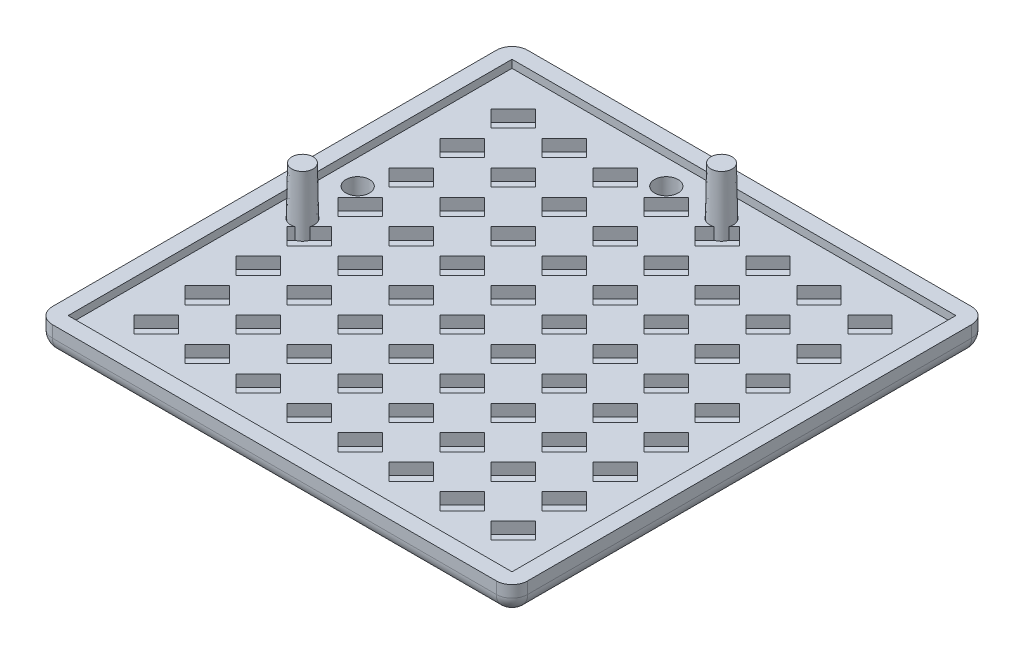
from build123d import *

# Parameters (mm, degrees)
SKETCH1_W                     = 60.6
SKETCH1_H                     = 60.6
BOSS_EXTRUDE1_DEPTH           = 3.5
CUT_EXTRUDE1_START            = -1
CUT_EXTRUDE1_DEPTH            = 42.993371582
CUT_EXTRUDE2_START            = -1
SKETCH3_W                     = 56.6
SKETCH3_H                     = 56.6
CUT_EXTRUDE2_DEPTH            = 44.993371582
SKETCH4_R                     = 1.5
CUT_EXTRUDE3_DEPTH            = 43.993371582
BOSS_EXTRUDE3_START           = -3.5
SKETCH5_R                     = 1.5
BOSS_EXTRUDE3_DEPTH           = 8.6
BOSS_EXTRUDE3_DRAFT           = 1
BOSS_EXTRUDE3_PROFILE_2_DEPTH = 8.6
BOSS_EXTRUDE3_PROFILE_2_DRAFT = 1
FILLET3_R                     = 2
FILLET4_R                     = 2


with BuildPart() as part:
    # Sketch1 → Boss-Extrude1 (new body)
    with BuildSketch(Plane(origin=(0, 0, 0), x_dir=(1, 0, 0), z_dir=(0, 1, 0))):
        Rectangle(SKETCH1_W, SKETCH1_H)
    extrude(amount=BOSS_EXTRUDE1_DEPTH)

    # led → Cut-Extrude1 (cut, through all)
    with BuildSketch(Plane.XZ.offset(CUT_EXTRUDE1_START)):
        Polygon((22.471572875, -20.350252532), (25.3, -23.178679656), (23.178679656, -25.3), (20.350252532, -22.471572875), align=None)
        Polygon((13.850252532, -22.471572875), (16.678679656, -25.3), (18.8, -23.178679656), (15.971572875, -20.350252532), align=None)
        Polygon((7.350252532, -22.471572875), (10.178679656, -25.3), (12.3, -23.178679656), (9.471572875, -20.350252532), align=None)
        Polygon((0.850252532, -22.471572875), (3.678679656, -25.3), (5.8, -23.178679656), (2.971572875, -20.350252532), align=None)
        Polygon((-5.649747468, -22.471572875), (-2.821320344, -25.3), (-0.7, -23.178679656), (-3.528427125, -20.350252532), align=None)
        Polygon((-12.149747468, -22.471572875), (-9.321320344, -25.3), (-7.2, -23.178679656), (-10.028427125, -20.350252532), align=None)
        Polygon((-18.649747468, -22.471572875), (-15.821320344, -25.3), (-13.7, -23.178679656), (-16.528427125, -20.350252532), align=None)
        Polygon((-25.149747468, -22.471572875), (-22.321320344, -25.3), (-20.2, -23.178679656), (-23.028427125, -20.350252532), align=None)
        Polygon((13.850252532, -15.971572875), (16.678679656, -18.8), (18.8, -16.678679656), (15.971572875, -13.850252532), align=None)
        Polygon((7.350252532, -15.971572875), (10.178679656, -18.8), (12.3, -16.678679656), (9.471572875, -13.850252532), align=None)
        Polygon((0.850252532, -15.971572875), (3.678679656, -18.8), (5.8, -16.678679656), (2.971572875, -13.850252532), align=None)
        Polygon((-5.649747468, -15.971572875), (-2.821320344, -18.8), (-0.7, -16.678679656), (-3.528427125, -13.850252532), align=None)
        Polygon((-12.149747468, -15.971572875), (-9.321320344, -18.8), (-7.2, -16.678679656), (-10.028427125, -13.850252532), align=None)
        Polygon((-18.649747468, -15.971572875), (-15.821320344, -18.8), (-13.7, -16.678679656), (-16.528427125, -13.850252532), align=None)
        Polygon((-25.149747468, -15.971572875), (-22.321320344, -18.8), (-20.2, -16.678679656), (-23.028427125, -13.850252532), align=None)
        Polygon((13.850252532, -9.471572875), (16.678679656, -12.3), (18.8, -10.178679656), (15.971572875, -7.350252532), align=None)
        Polygon((7.350252532, -9.471572875), (10.178679656, -12.3), (12.3, -10.178679656), (9.471572875, -7.350252532), align=None)
        Polygon((0.850252532, -9.471572875), (3.678679656, -12.3), (5.8, -10.178679656), (2.971572875, -7.350252532), align=None)
        Polygon((-5.649747468, -9.471572875), (-2.821320344, -12.3), (-0.7, -10.178679656), (-3.528427125, -7.350252532), align=None)
        Polygon((-12.149747468, -9.471572875), (-9.321320344, -12.3), (-7.2, -10.178679656), (-10.028427125, -7.350252532), align=None)
        Polygon((-18.649747468, -9.471572875), (-15.821320344, -12.3), (-13.7, -10.178679656), (-16.528427125, -7.350252532), align=None)
        Polygon((-25.149747468, -9.471572875), (-22.321320344, -12.3), (-20.2, -10.178679656), (-23.028427125, -7.350252532), align=None)
        Polygon((13.850252532, -2.971572875), (16.678679656, -5.8), (18.8, -3.678679656), (15.971572875, -0.850252532), align=None)
        Polygon((7.350252532, -2.971572875), (10.178679656, -5.8), (12.3, -3.678679656), (9.471572875, -0.850252532), align=None)
        Polygon((0.850252532, -2.971572875), (3.678679656, -5.8), (5.8, -3.678679656), (2.971572875, -0.850252532), align=None)
        Polygon((-5.649747468, -2.971572875), (-2.821320344, -5.8), (-0.7, -3.678679656), (-3.528427125, -0.850252532), align=None)
        Polygon((-12.149747468, -2.971572875), (-9.321320344, -5.8), (-7.2, -3.678679656), (-10.028427125, -0.850252532), align=None)
        Polygon((-18.649747468, -2.971572875), (-15.821320344, -5.8), (-13.7, -3.678679656), (-16.528427125, -0.850252532), align=None)
        Polygon((-25.149747468, -2.971572875), (-22.321320344, -5.8), (-20.2, -3.678679656), (-23.028427125, -0.850252532), align=None)
        Polygon((13.850252532, 3.528427125), (16.678679656, 0.7), (18.8, 2.821320344), (15.971572875, 5.649747468), align=None)
        Polygon((7.350252532, 3.528427125), (10.178679656, 0.7), (12.3, 2.821320344), (9.471572875, 5.649747468), align=None)
        Polygon((0.850252532, 3.528427125), (3.678679656, 0.7), (5.8, 2.821320344), (2.971572875, 5.649747468), align=None)
        Polygon((-5.649747468, 3.528427125), (-2.821320344, 0.7), (-0.7, 2.821320344), (-3.528427125, 5.649747468), align=None)
        Polygon((-12.149747468, 3.528427125), (-9.321320344, 0.7), (-7.2, 2.821320344), (-10.028427125, 5.649747468), align=None)
        Polygon((-18.649747468, 3.528427125), (-15.821320344, 0.7), (-13.7, 2.821320344), (-16.528427125, 5.649747468), align=None)
        Polygon((-25.149747468, 3.528427125), (-22.321320344, 0.7), (-20.2, 2.821320344), (-23.028427125, 5.649747468), align=None)
        Polygon((13.850252532, 10.028427125), (16.678679656, 7.2), (18.8, 9.321320344), (15.971572875, 12.149747468), align=None)
        Polygon((7.350252532, 10.028427125), (10.178679656, 7.2), (12.3, 9.321320344), (9.471572875, 12.149747468), align=None)
        Polygon((0.850252532, 10.028427125), (3.678679656, 7.2), (5.8, 9.321320344), (2.971572875, 12.149747468), align=None)
        Polygon((-5.649747468, 10.028427125), (-2.821320344, 7.2), (-0.7, 9.321320344), (-3.528427125, 12.149747468), align=None)
        Polygon((-12.149747468, 10.028427125), (-9.321320344, 7.2), (-7.2, 9.321320344), (-10.028427125, 12.149747468), align=None)
        Polygon((-18.649747468, 10.028427125), (-15.821320344, 7.2), (-13.7, 9.321320344), (-16.528427125, 12.149747468), align=None)
        Polygon((-25.149747468, 10.028427125), (-22.321320344, 7.2), (-20.2, 9.321320344), (-23.028427125, 12.149747468), align=None)
        Polygon((13.850252532, 16.528427125), (16.678679656, 13.7), (18.8, 15.821320344), (15.971572875, 18.649747468), align=None)
        Polygon((7.350252532, 16.528427125), (10.178679656, 13.7), (12.3, 15.821320344), (9.471572875, 18.649747468), align=None)
        Polygon((0.850252532, 16.528427125), (3.678679656, 13.7), (5.8, 15.821320344), (2.971572875, 18.649747468), align=None)
        Polygon((-5.649747468, 16.528427125), (-2.821320344, 13.7), (-0.7, 15.821320344), (-3.528427125, 18.649747468), align=None)
        Polygon((-12.149747468, 16.528427125), (-9.321320344, 13.7), (-7.2, 15.821320344), (-10.028427125, 18.649747468), align=None)
        Polygon((-18.649747468, 16.528427125), (-15.821320344, 13.7), (-13.7, 15.821320344), (-16.528427125, 18.649747468), align=None)
        Polygon((-25.149747468, 16.528427125), (-22.321320344, 13.7), (-20.2, 15.821320344), (-23.028427125, 18.649747468), align=None)
        Polygon((13.850252532, 23.028427125), (16.678679656, 20.2), (18.8, 22.321320344), (15.971572875, 25.149747468), align=None)
        Polygon((7.350252532, 23.028427125), (10.178679656, 20.2), (12.3, 22.321320344), (9.471572875, 25.149747468), align=None)
        Polygon((0.850252532, 23.028427125), (3.678679656, 20.2), (5.8, 22.321320344), (2.971572875, 25.149747468), align=None)
        Polygon((-5.649747468, 23.028427125), (-2.821320344, 20.2), (-0.7, 22.321320344), (-3.528427125, 25.149747468), align=None)
        Polygon((-12.149747468, 23.028427125), (-9.321320344, 20.2), (-7.2, 22.321320344), (-10.028427125, 25.149747468), align=None)
        Polygon((-18.649747468, 23.028427125), (-15.821320344, 20.2), (-13.7, 22.321320344), (-16.528427125, 25.149747468), align=None)
        Polygon((-25.149747468, 23.028427125), (-22.321320344, 20.2), (-20.2, 22.321320344), (-23.028427125, 25.149747468), align=None)
        Polygon((20.350252532, -15.971572875), (23.178679656, -18.8), (25.3, -16.678679656), (22.471572875, -13.850252532), align=None)
        Polygon((20.350252532, -9.471572875), (23.178679656, -12.3), (25.3, -10.178679656), (22.471572875, -7.350252532), align=None)
        Polygon((20.350252532, -2.971572875), (23.178679656, -5.8), (25.3, -3.678679656), (22.471572875, -0.850252532), align=None)
        Polygon((20.350252532, 3.528427125), (23.178679656, 0.7), (25.3, 2.821320344), (22.471572875, 5.649747468), align=None)
        Polygon((20.350252532, 10.028427125), (23.178679656, 7.2), (25.3, 9.321320344), (22.471572875, 12.149747468), align=None)
        Polygon((20.350252532, 16.528427125), (23.178679656, 13.7), (25.3, 15.821320344), (22.471572875, 18.649747468), align=None)
        Polygon((20.350252532, 23.028427125), (23.178679656, 20.2), (25.3, 22.321320344), (22.471572875, 25.149747468), align=None)
    extrude(amount=-CUT_EXTRUDE1_DEPTH, mode=Mode.SUBTRACT)

    # Sketch3 → Cut-Extrude2 (cut, through all)
    with BuildSketch(Plane(origin=(0, 3.5, 0), x_dir=(1, 0, 0), z_dir=(0, 1, 0)).offset(CUT_EXTRUDE2_START)):
        Rectangle(SKETCH3_W, SKETCH3_H)
    extrude(amount=CUT_EXTRUDE2_DEPTH, mode=Mode.SUBTRACT)

    # Sketch4 → Cut-Extrude3 (cut, through all)
    with BuildSketch(Plane(origin=(0, 3.5, 0), x_dir=(1, 0, 0), z_dir=(0, 1, 0))):
        with Locations(Location((1.6, 25.12, 0), (0, 0, 270))):
            Circle(SKETCH4_R)
        with Locations(Location((-5.44, 25.12, 0), (0, 0, 270))):
            Circle(SKETCH4_R)
        with Locations(Location((-25.12, 5.44, 0), (0, 0, 270))):
            Circle(SKETCH4_R)
        with Locations(Location((-25.12, -1.6, 0), (0, 0, 288.514361265))):
            Circle(SKETCH4_R)
    extrude(amount=-CUT_EXTRUDE3_DEPTH, mode=Mode.SUBTRACT)

    # Fillet3
    fillet3_edges = [part.edges().sort_by_distance(p)[0] for p in [
        (30.3, 1.75, 30.3),
        (-30.3, 1.75, 30.3),
        (-30.3, 1.75, -30.3),
        (30.3, 1.75, -30.3),
    ]]
    fillet(fillet3_edges, radius=FILLET3_R)

    # Fillet4
    fillet4_edges = [part.edges().sort_by_distance(p)[0] for p in [
        (0, 0, 30.3),
        (30.3, 0, 0),
        (-30.3, 0, 0),
        (0, 0, -30.3),
        (29.714213562, 0, 29.714213562),
        (29.714213562, 0, -29.714213562),
        (-29.714213562, 0, -29.714213562),
        (-29.714213562, 0, 29.714213562),
    ]]
    fillet(fillet4_edges, radius=FILLET4_R)


with BuildPart() as body_2:
    # Sketch5 → Boss-Extrude3 (with draft: the straight prism first)
    with BuildSketch(Plane(origin=(0, 3.5, 0), x_dir=(1, 0, 0), z_dir=(0, 1, 0)).offset(BOSS_EXTRUDE3_START)):
        with Locations(Location((-25.12, -1.6, 0), (0, 0, 288.514361265))):
            Circle(SKETCH5_R)
    extrude(amount=BOSS_EXTRUDE3_DEPTH)
    # Boss-Extrude3: the draft: its side faces are tilted about the plane it starts from
    boss_extrude3_sides = [body_2.faces().sort_by_distance(p)[0] for p in [
        (-25.596313518, 4.3, 0.177633861),
    ]]
    draft(boss_extrude3_sides, Plane(origin=(0, 3.5, 0), x_dir=(1, 0, 0), z_dir=(0, 1, 0)).offset(BOSS_EXTRUDE3_START), BOSS_EXTRUDE3_DRAFT)


with BuildPart() as body_3:
    # Sketch5 → Boss-Extrude3 profile 2 (with draft: the straight prism first)
    with BuildSketch(Plane(origin=(0, 3.5, 0), x_dir=(1, 0, 0), z_dir=(0, 1, 0)).offset(BOSS_EXTRUDE3_START)):
        with Locations(Location((1.6, 25.12, 0), (0, 0, 270))):
            Circle(SKETCH5_R)
    extrude(amount=BOSS_EXTRUDE3_PROFILE_2_DEPTH)
    # Boss-Extrude3 profile 2: the draft: its side faces are tilted about the plane it starts from
    boss_extrude3_profile_2_sides = [body_3.faces().sort_by_distance(p)[0] for p in [
        (1.6, 4.3, -26.62),
    ]]
    draft(boss_extrude3_profile_2_sides, Plane(origin=(0, 3.5, 0), x_dir=(1, 0, 0), z_dir=(0, 1, 0)).offset(BOSS_EXTRUDE3_START), BOSS_EXTRUDE3_PROFILE_2_DRAFT)


solid = Compound([part.part, body_2.part, body_3.part])
